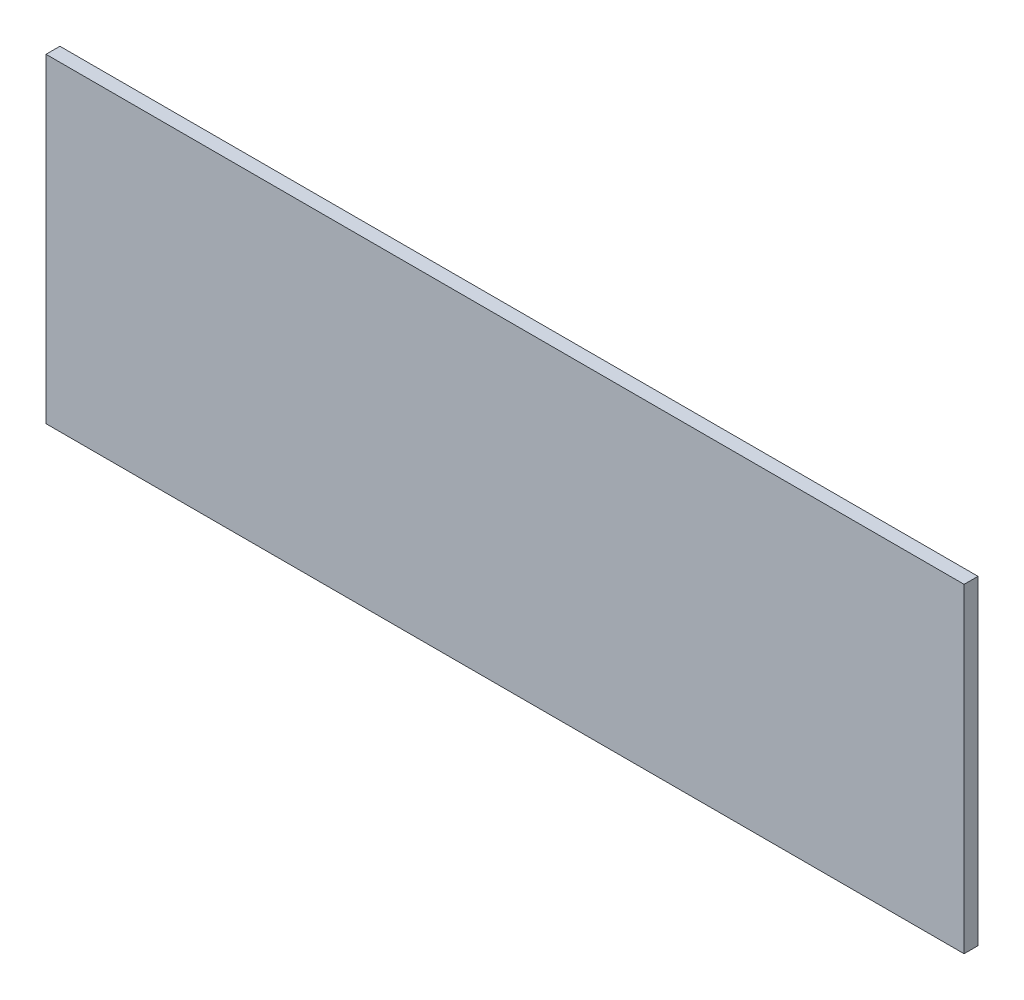
from build123d import *

# Parameters (mm, degrees)
SKETCH_1_W      = 660
SKETCH_1_H      = 230
EXTRUDE_1_DEPTH = 10


with BuildPart() as part:
    # 草图1 → 凸台-拉伸1 (new body)
    with BuildSketch(Plane.XY):
        Rectangle(SKETCH_1_W, SKETCH_1_H)
    extrude(amount=EXTRUDE_1_DEPTH)


solid = part.part
